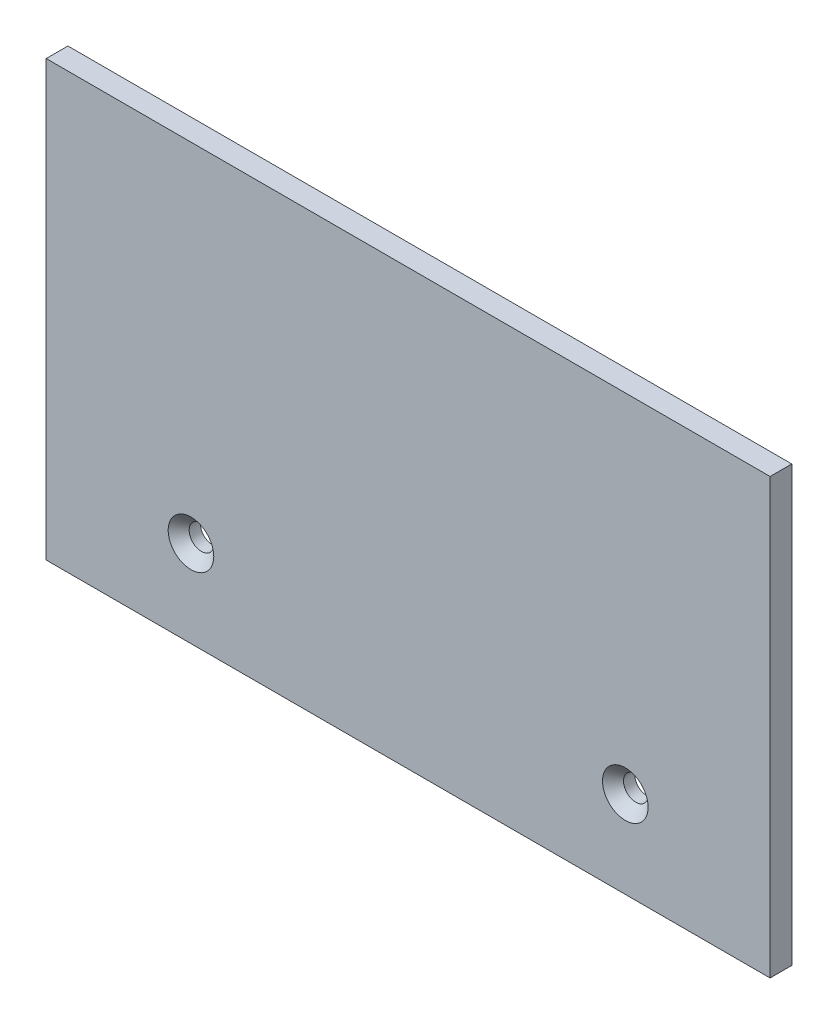
from build123d import *

# Parameters (mm, degrees)
SKETCH1_W                                    = 100
SKETCH1_H                                    = 60
BOSS_EXTRUDE1_DEPTH                          = 1.5
CSK_FOR_M3_COUNTERSUNK_FLAT_HEAD_SCR_2_COUNT = 2
CSK_FOR_M3_COUNTERSUNK_FLAT_HEAD_SCR_2_PITCH = 60


with BuildPart() as part:
    # Sketch1 → Boss-Extrude1 (new, symmetric)
    with BuildSketch(Plane.XY):
        Rectangle(SKETCH1_W, SKETCH1_H)
    extrude(amount=BOSS_EXTRUDE1_DEPTH, both=True)

    # Sketch3 → CSK for M3 Countersunk Flat Head Screw1 (revolve, cut)
    with BuildSketch(Plane(origin=(-30, -18, 1.5), x_dir=(0, -1, 0), z_dir=(1, 0, 0))):
        Polygon((0, 0), (0, 3), (1.7, 3), (1.7, 1.45), (3.15, 0), align=None)
    csk_for_m3_countersunk_flat_head_screw1 = revolve(axis=Axis((-30, -18, 7.85), (0, 0, -1)), mode=Mode.SUBTRACT)

    # CSK for M3 Countersunk Flat Head Scr 2: CSK for M3 Countersunk Flat Head Screw1 ×2
    with Locations(*[(i * CSK_FOR_M3_COUNTERSUNK_FLAT_HEAD_SCR_2_PITCH, 0, 0) for i in range(1, CSK_FOR_M3_COUNTERSUNK_FLAT_HEAD_SCR_2_COUNT)]):
        add(csk_for_m3_countersunk_flat_head_screw1, mode=Mode.SUBTRACT)


solid = part.part
